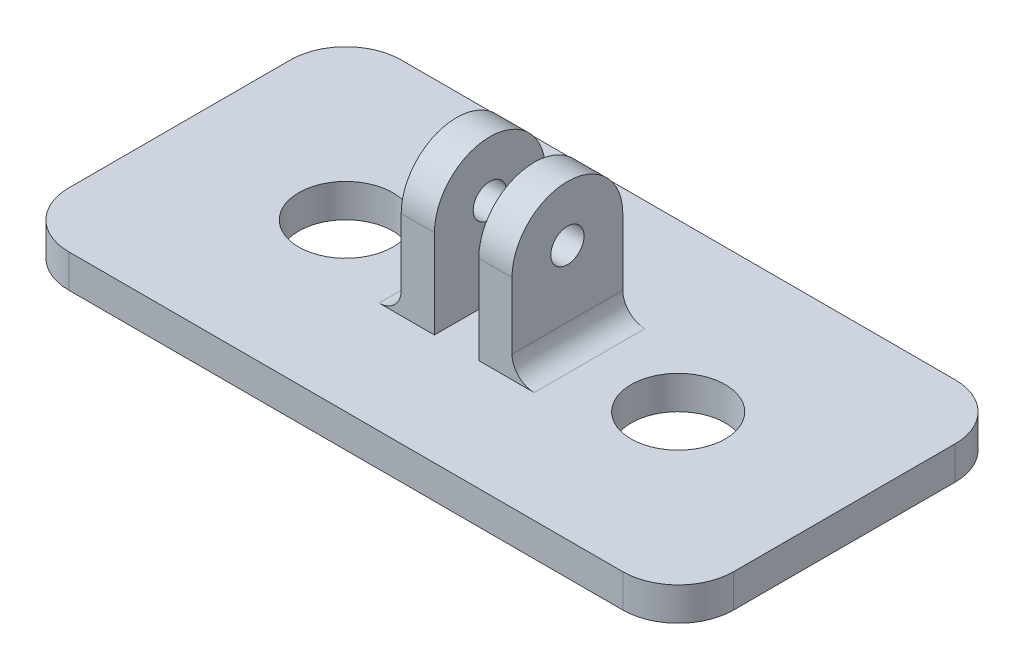
from build123d import *

# Parameters (mm, degrees)
CROQUIS1_W              = 60
CROQUIS1_H              = 30
SALIENTE_EXTRUIR1_DEPTH = 3
CROQUIS2_R              = 4.25
CORTAR_EXTRUIR1_DEPTH   = 3
REDONDEO1_R             = 5
CROQUIS4_W              = 3
CROQUIS4_H              = 10
SALIENTE_EXTRUIR2_DEPTH = 13
CORTAR_EXTRUIR2_DEPTH   = 13
CROQUIS6_R              = 1.5
CORTAR_EXTRUIR3_DEPTH   = 13
SALIENTE_EXTRUIR3_DEPTH = 10


with BuildPart() as part:
    # Croquis1 → Saliente-Extruir1 (new body)
    with BuildSketch(Plane(origin=(0, 0, 0), x_dir=(1, 0, 0), z_dir=(0, 1, 0))):
        Rectangle(CROQUIS1_W, CROQUIS1_H)
    extrude(amount=SALIENTE_EXTRUIR1_DEPTH)

    # Croquis2 → Cortar-Extruir1 (cut)
    with BuildSketch(Plane(origin=(0, 3, 0), x_dir=(1, 0, 0), z_dir=(0, 1, 0))):
        with Locations(Location((-15, 0, 0), (0, 0, 270))):
            Circle(CROQUIS2_R)
        with Locations(Location((15, 0, 0), (0, 0, 270))):
            Circle(CROQUIS2_R)
    extrude(amount=-CORTAR_EXTRUIR1_DEPTH, mode=Mode.SUBTRACT)

    # Redondeo1
    redondeo1_edges = [part.edges().sort_by_distance(p)[0] for p in [
        (30, 1.5, 15),
        (-30, 1.5, 15),
        (-30, 1.5, -15),
        (30, 1.5, -15),
    ]]
    fillet(redondeo1_edges, radius=REDONDEO1_R)

    # Croquis4 → Saliente-Extruir2 (add)
    with BuildSketch(Plane(origin=(0, 3, 0), x_dir=(1, 0, 0), z_dir=(0, 1, 0))):
        with Locations((-3.5, 0)):
            Rectangle(CROQUIS4_W, CROQUIS4_H)
        with Locations((3.5, 0)):
            Rectangle(CROQUIS4_W, CROQUIS4_H)
    extrude(amount=SALIENTE_EXTRUIR2_DEPTH)

    # Croquis5 → Cortar-Extruir2 (cut)
    with BuildSketch(Plane(origin=(5, 0, 0), x_dir=(0, 0, -1), z_dir=(1, 0, 0))):
        with BuildLine():
            Line((-5, 16), (-5, 11))
            ThreePointArc((-5, 11), (-3.535533906, 14.535533906), (0, 16))
            Line((0, 16), (-5, 16))
        make_face()
        with BuildLine():
            ThreePointArc((0, 16), (3.535533906, 14.535533906), (5, 11))
            Line((5, 11), (5, 16))
            Line((5, 16), (0, 16))
        make_face()
    extrude(amount=-CORTAR_EXTRUIR2_DEPTH, mode=Mode.SUBTRACT)

    # Croquis6 → Cortar-Extruir3 (cut)
    with BuildSketch(Plane.ZY.offset(5)):
        with Locations((0, 11)):
            Circle(CROQUIS6_R)
    extrude(amount=-CORTAR_EXTRUIR3_DEPTH, mode=Mode.SUBTRACT)

    # Croquis7 → Saliente-Extruir3 (add)
    with BuildSketch(Plane.XY.offset(5)):
        with BuildLine():
            Line((-7, 3), (-5, 3))
            Line((-5, 3), (-5, 5))
            ThreePointArc((-5, 5), (-5.585786438, 3.585786438), (-7, 3))
        make_face()
        with BuildLine():
            Line((5, 5), (5, 3))
            Line((5, 3), (7, 3))
            ThreePointArc((7, 3), (5.585786438, 3.585786438), (5, 5))
        make_face()
    extrude(amount=-SALIENTE_EXTRUIR3_DEPTH)


solid = part.part
